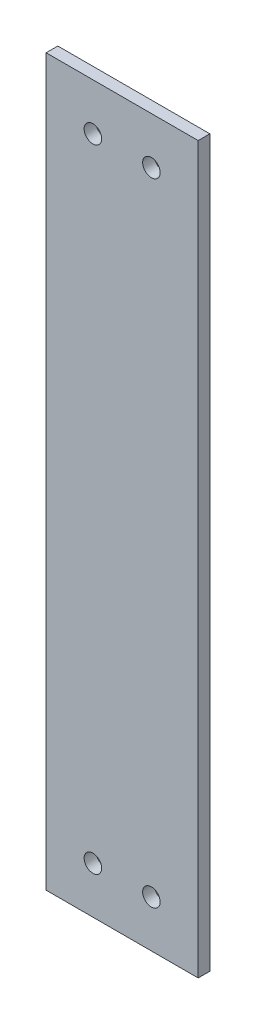
from build123d import *

# Parameters (mm, degrees)
SKETCH_1_W      = 26
SKETCH_1_H      = 124
SKETCH_1_R      = 1.5
EXTRUDE_1_DEPTH = 2


with BuildPart() as part:
    # Эскиз1 → Бобышка-Вытянуть1 (new body)
    with BuildSketch(Plane.XY):
        with Locations((13, 62)):
            Rectangle(SKETCH_1_W, SKETCH_1_H)
        with Locations((8, 8)):
            Circle(SKETCH_1_R, mode=Mode.SUBTRACT)
        with Locations((18, 8)):
            Circle(SKETCH_1_R, mode=Mode.SUBTRACT)
        with Locations((18, 116)):
            Circle(SKETCH_1_R, mode=Mode.SUBTRACT)
        with Locations((8, 116)):
            Circle(SKETCH_1_R, mode=Mode.SUBTRACT)
    extrude(amount=EXTRUDE_1_DEPTH)


solid = part.part
